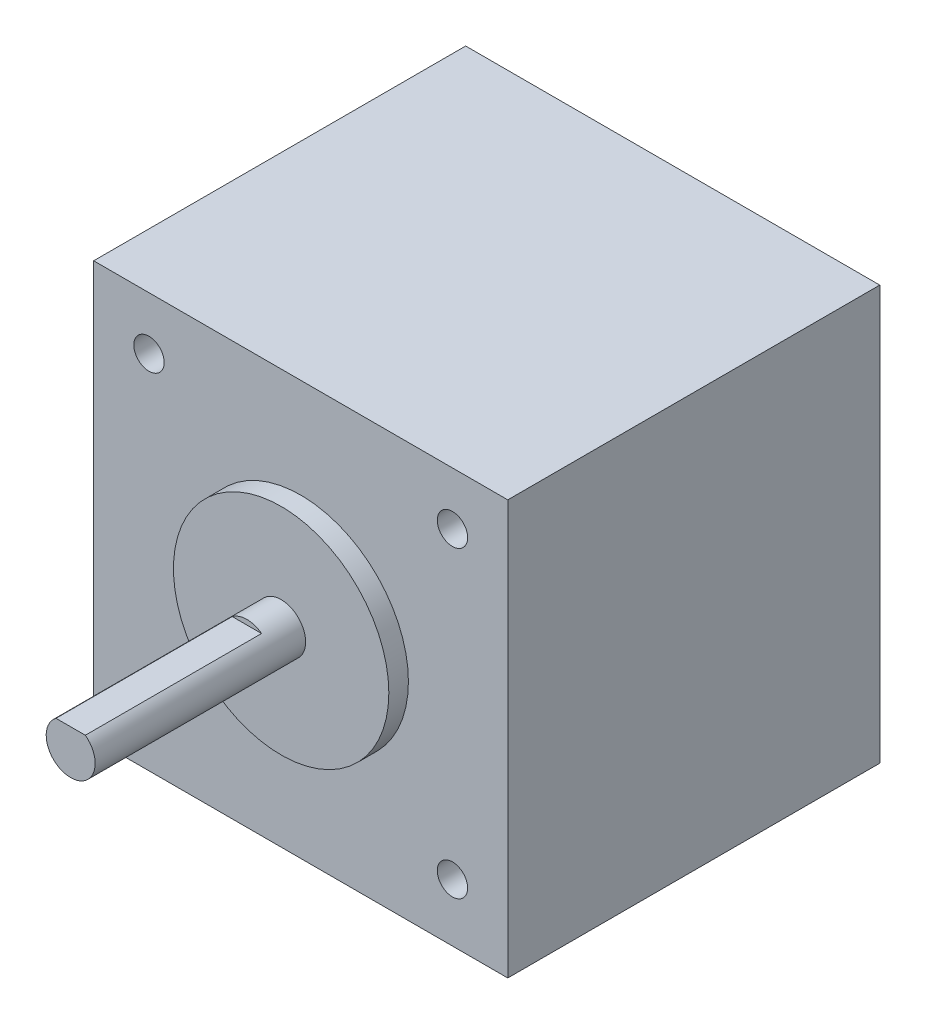
from build123d import *

# Parameters (mm, degrees)
SKETCH1_W           = 42.3
SKETCH1_H           = 42.3
BOSS_EXTRUDE1_DEPTH = 38
SKETCH2_R           = 11
BOSS_EXTRUDE2_DEPTH = 2
SKETCH3_R           = 2.5
BOSS_EXTRUDE4_DEPTH = 21.5
CUT_EXTRUDE1_START  = -18
CUT_EXTRUDE1_DEPTH  = 18
SKETCH5_R           = 1.55
CUT_EXTRUDE2_DEPTH  = 4.5
SKETCH6_OUTSIDE_W   = 61.46
SKETCH6_OUTSIDE_H   = 61.46
SKETCH6_OUTSIDE_W_2 = 42.3
SKETCH6_OUTSIDE_H_2 = 42.3
SKETCH6_OUTSIDE_R   = 1.55
CUT_EXTRUDE3_DEPTH  = 4.5


with BuildPart() as part:
    # Sketch1 → Boss-Extrude1 (new body)
    with BuildSketch(Plane.XY):
        with Locations((21.15, 21.15)):
            Rectangle(SKETCH1_W, SKETCH1_H)
    extrude(amount=BOSS_EXTRUDE1_DEPTH)

    # Sketch2 → Boss-Extrude2 (add)
    with BuildSketch(Plane.XY.offset(38)):
        with Locations((21.15, 21.15)):
            Circle(SKETCH2_R)
    extrude(amount=BOSS_EXTRUDE2_DEPTH)

    # Sketch3 → Boss-Extrude4 (add)
    with BuildSketch(Plane.XY.offset(40)):
        with Locations((21.15, 21.4)):
            Circle(SKETCH3_R)
    extrude(amount=BOSS_EXTRUDE4_DEPTH)

    # Sketch4 → Cut-Extrude1 (cut)
    with BuildSketch(Plane.XY.offset(61.5).offset(CUT_EXTRUDE1_START)):
        with BuildLine():
            Line((21.15, 23.4), (22.65, 23.4))
            ThreePointArc((22.65, 23.4), (21.15, 23.9), (19.65, 23.4))
            Line((19.65, 23.4), (21.15, 23.4))
        make_face()
    extrude(amount=CUT_EXTRUDE1_DEPTH, mode=Mode.SUBTRACT)

    # Sketch5 → Cut-Extrude2 (cut)
    with BuildSketch(Plane.XY.offset(38)):
        with Locations((5.65, 36.9)):
            Circle(SKETCH5_R)
        with Locations((36.65, 36.9)):
            Circle(SKETCH5_R)
        with Locations((36.65, 5.9)):
            Circle(SKETCH5_R)
        with Locations((5.65, 5.9)):
            Circle(SKETCH5_R)
    extrude(amount=-CUT_EXTRUDE2_DEPTH, mode=Mode.SUBTRACT)

    # Sketch6 outside → Cut-Extrude3 (cut)
    # profile 1 of 5: a face of its own
    with BuildSketch(Plane(origin=(0, 0, 0), x_dir=(-1, 0, 0), z_dir=(0, 0, -1))):
        with Locations((-21.15, 21.15)):
            Rectangle(SKETCH6_OUTSIDE_W, SKETCH6_OUTSIDE_H)
        with Locations((-21.15, 21.15)):
            Rectangle(SKETCH6_OUTSIDE_W_2, SKETCH6_OUTSIDE_H_2, mode=Mode.SUBTRACT)
    # profile 2 of 5: a face of its own
    with BuildSketch(Plane(origin=(0, 0, 0), x_dir=(-1, 0, 0), z_dir=(0, 0, -1))):
        with Locations(Location((-5.65, 36.9, 0), (0, 0, 180))):
            Circle(SKETCH6_OUTSIDE_R)
    # profile 3 of 5: a face of its own
    with BuildSketch(Plane(origin=(0, 0, 0), x_dir=(-1, 0, 0), z_dir=(0, 0, -1))):
        with Locations(Location((-36.65, 36.9, 0), (0, 0, 180))):
            Circle(SKETCH6_OUTSIDE_R)
    # profile 4 of 5: a face of its own
    with BuildSketch(Plane(origin=(0, 0, 0), x_dir=(-1, 0, 0), z_dir=(0, 0, -1))):
        with Locations(Location((-36.65, 5.9, 0), (0, 0, 180))):
            Circle(SKETCH6_OUTSIDE_R)
    # profile 5 of 5: a face of its own
    with BuildSketch(Plane(origin=(0, 0, 0), x_dir=(-1, 0, 0), z_dir=(0, 0, -1))):
        with Locations(Location((-5.65, 5.9, 0), (0, 0, 180))):
            Circle(SKETCH6_OUTSIDE_R)
    extrude(amount=-CUT_EXTRUDE3_DEPTH, mode=Mode.SUBTRACT)


solid = part.part
